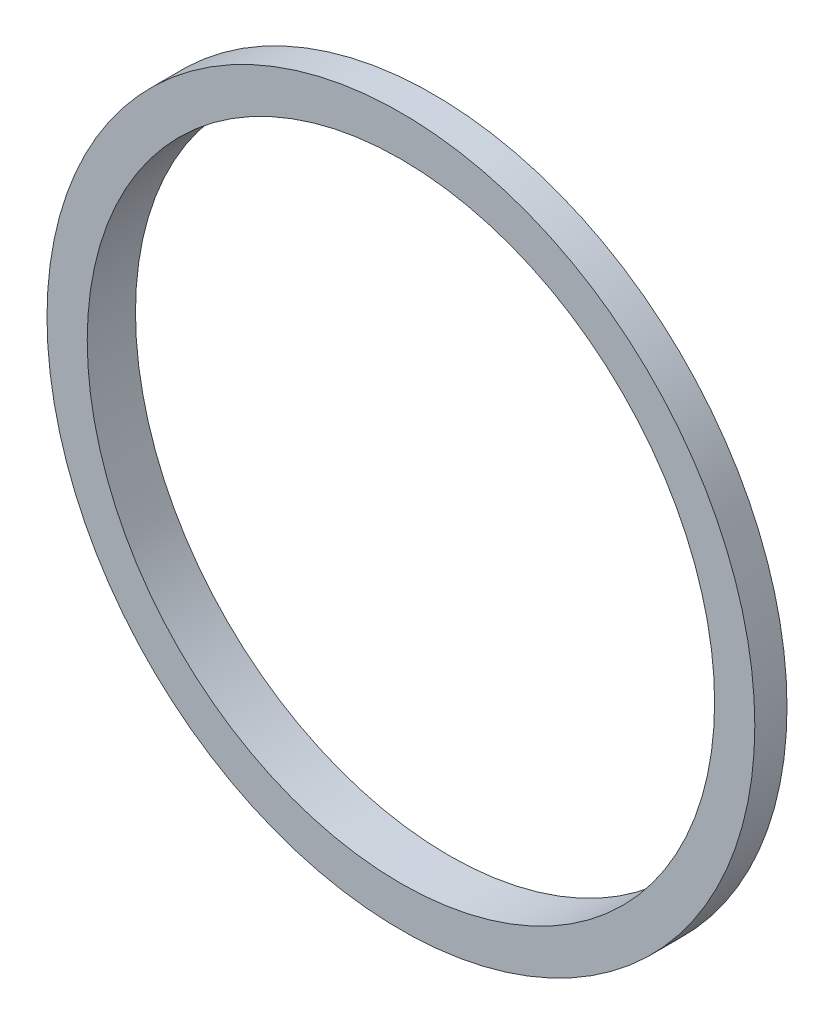
from build123d import *

# Parameters (mm, degrees)
SKETCH1_R           = 22
BOSS_EXTRUDE2_DEPTH = 2
SKETCH4_R           = 20.5
BOSS_EXTRUDE3_DEPTH = 1
SKETCH5_R           = 19.5
CUT_EXTRUDE1_DEPTH  = 32.256999216


with BuildPart() as part:
    # Sketch1 → Boss-Extrude2 (new body)
    with BuildSketch(Plane.XY):
        Circle(SKETCH1_R)
    extrude(amount=BOSS_EXTRUDE2_DEPTH)

    # Sketch4 → Boss-Extrude3 (add)
    with BuildSketch(Plane(origin=(0, 0, 0), x_dir=(-1, 0, 0), z_dir=(0, 0, -1))):
        Circle(SKETCH4_R)
    extrude(amount=BOSS_EXTRUDE3_DEPTH)

    # Sketch5 → Cut-Extrude1 (cut, through all)
    with BuildSketch(Plane(origin=(0, 0, -1), x_dir=(-1, 0, 0), z_dir=(0, 0, -1))):
        Circle(SKETCH5_R)
    extrude(amount=-CUT_EXTRUDE1_DEPTH, mode=Mode.SUBTRACT)


solid = part.part
